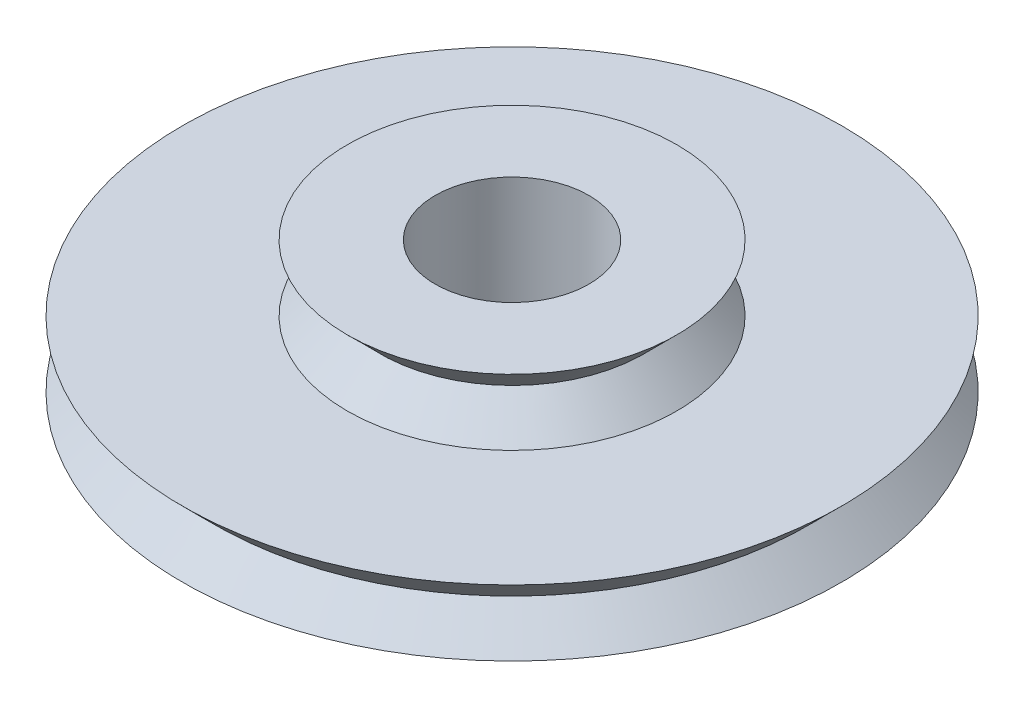
from build123d import *


with BuildPart() as part:
    # Sketch1 → Revolve1 (revolve)
    with BuildSketch(Plane.XY, mode=Mode.PRIVATE) as revolve1_sk:
        Polygon((-3.5, 6), (-3.5, 0), (-15, 0), (-13.5, 1.5), (-15, 3), (-7.5, 3), (-6, 4.5), (-7.5, 6), align=None)
    revolve(revolve1_sk.sketch.rotate(Axis((0, 0, 0), (0, 1, 0)), 270), axis=Axis((0, 0, 0), (0, 1, 0)))


solid = part.part
